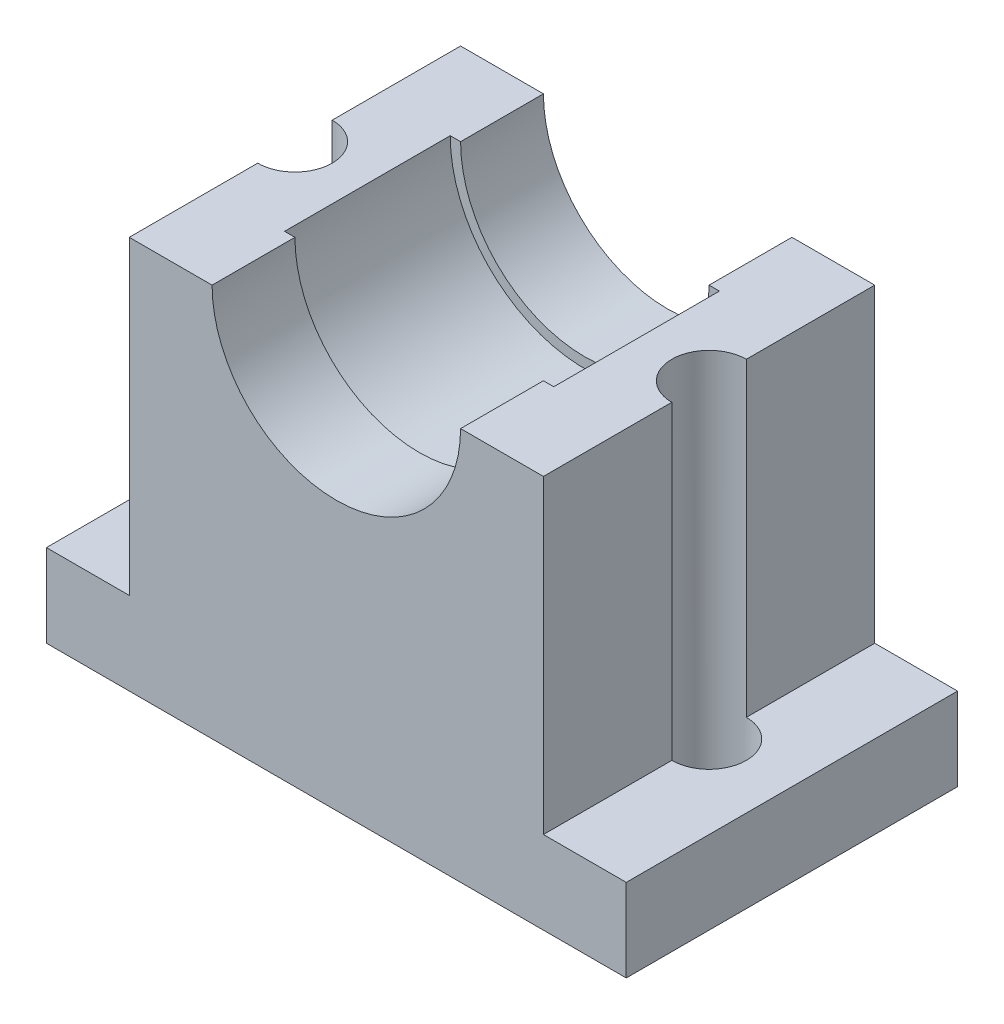
from build123d import *

# Parameters (mm, degrees)
SKETCH1_W           = 140
SKETCH1_H           = 80
BOSS_EXTRUDE1_DEPTH = 20
BOSS_EXTRUDE2_DEPTH = 80
SKETCH3_W           = 2.5
SKETCH3_H           = 40
SKETCH4_R           = 9
CUT_EXTRUDE1_DEPTH  = 125.510684884


with BuildPart() as part:
    # Sketch1 → Boss-Extrude1 (new body)
    with BuildSketch(Plane(origin=(0, 0, 0), x_dir=(1, 0, 0), z_dir=(0, 1, 0))):
        Rectangle(SKETCH1_W, SKETCH1_H)
    extrude(amount=BOSS_EXTRUDE1_DEPTH)

    # Sketch2 → Boss-Extrude2 (add, through all)
    with BuildSketch(Plane.XY.offset(40)):
        with BuildLine():
            Line((30, 94.883669039), (50, 94.883669039))
            Line((50, 94.883669039), (50, 20))
            Line((50, 20), (-50, 20))
            Line((-50, 20), (-50, 94.883669039))
            Line((-50, 94.883669039), (-30, 94.883669039))
            ThreePointArc((-30, 94.883669039), (0, 64.883669039), (30, 94.883669039))
        make_face()
    extrude(amount=-BOSS_EXTRUDE2_DEPTH)

    # Sketch3 → Cut-Revolve1 (revolve, cut)
    with BuildSketch(Plane(origin=(0, 94.883669039, 0), x_dir=(1, 0, 0), z_dir=(0, 1, 0))):
        with Locations((-31.25, 0)):
            Rectangle(SKETCH3_W, SKETCH3_H)
    revolve(axis=Axis((0, 94.883669039, 29.575987761), (0, 0, -1)), mode=Mode.SUBTRACT)

    # Sketch4 → Cut-Extrude1 (cut, through all)
    with BuildSketch(Plane(origin=(0, 94.883669039, 0), x_dir=(1, 0, 0), z_dir=(0, 1, 0))):
        with Locations(Location((50, 0, 0), (0, 0, 270))):
            Circle(SKETCH4_R)
    cut_extrude1 = extrude(amount=-CUT_EXTRUDE1_DEPTH, mode=Mode.SUBTRACT)

    # Mirror1: Cut-Extrude1 across plane
    add(cut_extrude1.mirror(Plane(origin=(0, 0, 0), x_dir=(0, 0, 1), z_dir=(1, 0, 0))), mode=Mode.SUBTRACT)


solid = part.part
